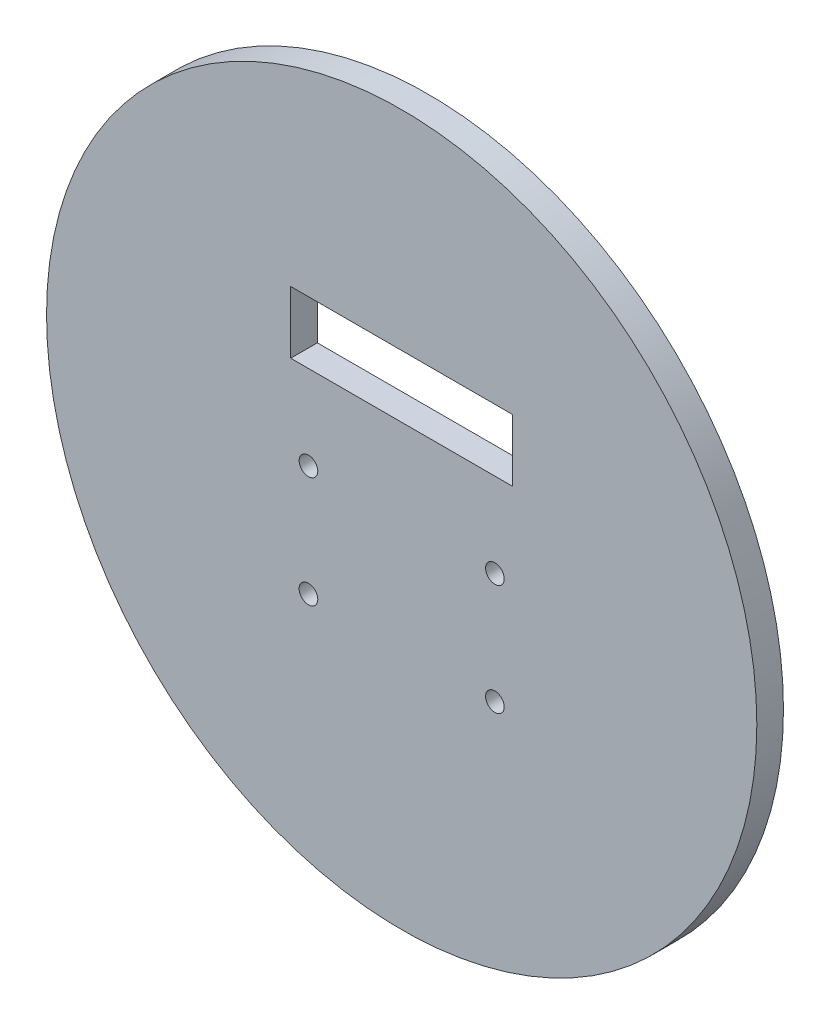
from build123d import *

# Parameters (mm, degrees)
ESQUISSE1_R                  = 40
ESQUISSE1_R_2                = 1.05
BOSS_EXTRU_1_DEPTH           = 3
ESQUISSE2_W                  = 25
ESQUISSE2_H                  = 7
ENL_V_MAT_EXTRU_4_DEPTH      = 14
BOSS_EXTRU_6_DEPTH           = 2
ENL_V_MAT_EXTRU_5_DEPTH      = 2
ESQUISSE2_9_W                = 25
ESQUISSE2_9_H                = 18.5
BOSS_EXTRU_7_DEPTH           = 2
ENL_V_MAT_EXTRU_6_DEPTH      = 57.648036153
ENL_V_MAT_EXTRU_6_DEPTH_BACK = 57.648036153
ESQUISSE7_R                  = 1.05


with BuildPart() as part:
    # Esquisse1 → Boss.-Extru.1 (new body)
    with BuildSketch(Plane.XY):
        Circle(ESQUISSE1_R)
        with Locations((-10.5, -12.5)):
            Circle(ESQUISSE1_R_2, mode=Mode.SUBTRACT)
        with Locations((10.5, -12.5)):
            Circle(ESQUISSE1_R_2, mode=Mode.SUBTRACT)
        with Locations((-10.5, 0)):
            Circle(ESQUISSE1_R_2, mode=Mode.SUBTRACT)
        with Locations((10.5, 0)):
            Circle(ESQUISSE1_R_2, mode=Mode.SUBTRACT)
    extrude(amount=BOSS_EXTRU_1_DEPTH)

    # Esquisse2 → Enlèv. mat.-Extru.4 (cut)
    with BuildSketch(Plane.XY):
        with Locations((0, 13)):
            Rectangle(ESQUISSE2_W, ESQUISSE2_H)
    extrude(amount=ENL_V_MAT_EXTRU_4_DEPTH, mode=Mode.SUBTRACT)

    # Esquisse2<7> → Boss.-Extru.6 (add)
    with BuildSketch(Plane.XY):
        Polygon((12.5, 4), (12.5, 9.5), (-12.5, 9.5), (-12.5, 4), (0, 4), align=None)
    extrude(amount=-BOSS_EXTRU_6_DEPTH)

    # Esquisse2<8> → Enlèv. mat.-Extru.5 (cut)
    with BuildSketch(Plane.XY):
        Polygon((12.5, 4), (12.5, 9.5), (-12.5, 9.5), (-12.5, 4), (0, 4), align=None)
    extrude(amount=-ENL_V_MAT_EXTRU_5_DEPTH, mode=Mode.SUBTRACT)

    # Esquisse2<9> → Boss.-Extru.7 (add)
    with BuildSketch(Plane.XY):
        with Locations((0, -5.25)):
            Rectangle(ESQUISSE2_9_W, ESQUISSE2_9_H)
    extrude(amount=-BOSS_EXTRU_7_DEPTH)

    # Esquisse7 → Enlèv. mat.-Extru.6 (cut, two sides: drawn at the far end of the back side and taken through both)
    with BuildSketch(Plane.XY.offset(-ENL_V_MAT_EXTRU_6_DEPTH_BACK)):
        with Locations((-10.5, 0)):
            Circle(ESQUISSE7_R)
        with Locations((-10.5, -12.5)):
            Circle(ESQUISSE7_R)
        with Locations((10.5, 0)):
            Circle(ESQUISSE7_R)
        with Locations((10.5, -12.5)):
            Circle(ESQUISSE7_R)
    extrude(amount=ENL_V_MAT_EXTRU_6_DEPTH + ENL_V_MAT_EXTRU_6_DEPTH_BACK, mode=Mode.SUBTRACT)


solid = part.part
